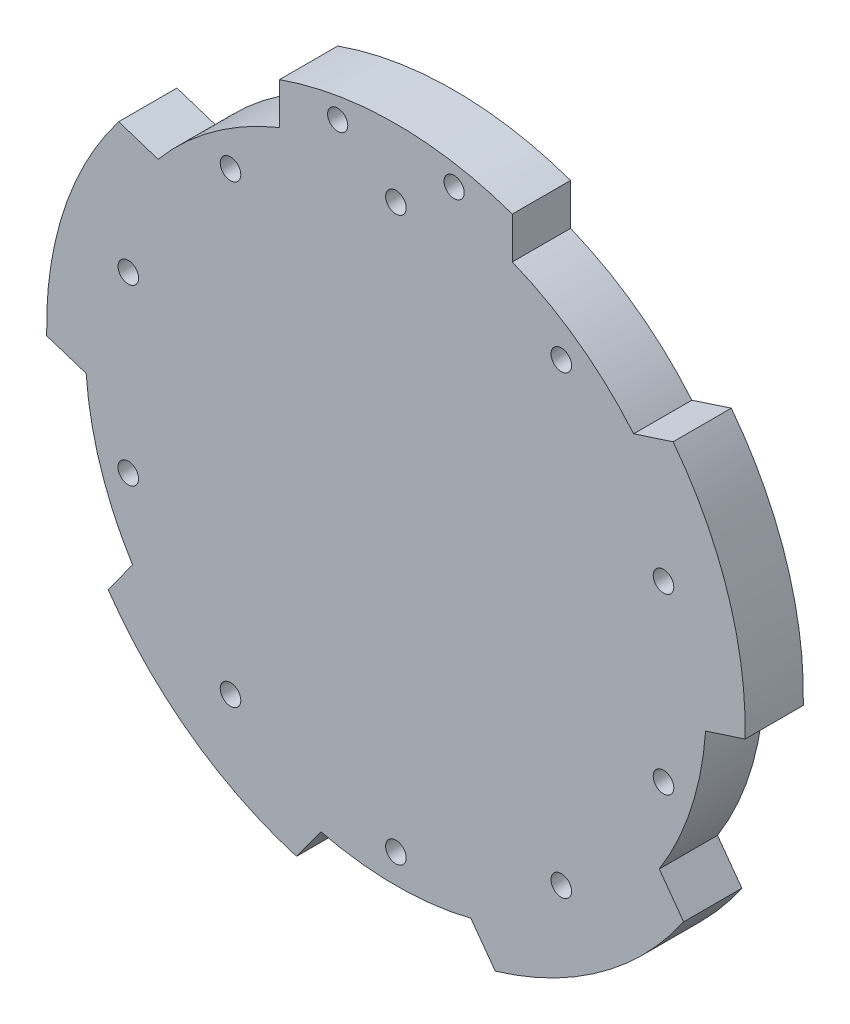
from build123d import *

# Parameters (mm, degrees)
SKIZZE1_R                       = 80
AUFSATZ_LINEAR_AUSTRAGEN1_DEPTH = 15
SKIZZE8_R                       = 2.65
SCHNITT_LINEAR_AUSTRAGEN1_DEPTH = 15
KREISMUSTER1_COUNT              = 10
SKIZZE9_R                       = 4.5
SCHNITT_LINEAR_AUSTRAGEN2_DEPTH = 5
KREISMUSTER2_COUNT              = 10
AUFSATZ_LINEAR_AUSTRAGEN2_DEPTH = 15
KREISMUSTER3_COUNT              = 5
SKIZZE11_R                      = 2.6
SCHNITT_LINEAR_AUSTRAGEN3_DEPTH = 15


with BuildPart() as part:
    # Skizze1 → Aufsatz-Linear austragen1 (new body)
    with BuildSketch(Plane.XY):
        Circle(SKIZZE1_R)
    extrude(amount=AUFSATZ_LINEAR_AUSTRAGEN1_DEPTH)

    # Skizze8 → Schnitt-Linear austragen1 (cut)
    with BuildSketch(Plane(origin=(0, 0, 0), x_dir=(-1, 0, 0), z_dir=(0, 0, -1))):
        with Locations((0, -72.5)):
            Circle(SKIZZE8_R)
    schnitt_linear_austragen1 = extrude(amount=-SCHNITT_LINEAR_AUSTRAGEN1_DEPTH, mode=Mode.SUBTRACT)

    # Kreismuster1: Schnitt-Linear austragen1 ×10 about axis
    kreismuster1_axis = Axis((0, 0, 0), (0, 0, 1))
    for i in range(1, KREISMUSTER1_COUNT):
        add(schnitt_linear_austragen1.rotate(kreismuster1_axis, i * 360 / KREISMUSTER1_COUNT), mode=Mode.SUBTRACT)

    # Skizze9 → Schnitt-Linear austragen2 (cut)
    with BuildSketch(Plane(origin=(0, 0, 0), x_dir=(-1, 0, 0), z_dir=(0, 0, -1))):
        with Locations((0, -72.5)):
            Circle(SKIZZE9_R)
    schnitt_linear_austragen2 = extrude(amount=-SCHNITT_LINEAR_AUSTRAGEN2_DEPTH, mode=Mode.SUBTRACT)

    # Kreismuster2: Schnitt-Linear austragen2 ×10 about axis
    kreismuster2_axis = Axis((0, 0, 0), (0, 0, 1))
    for i in range(1, KREISMUSTER2_COUNT):
        add(schnitt_linear_austragen2.rotate(kreismuster2_axis, i * 360 / KREISMUSTER2_COUNT), mode=Mode.SUBTRACT)

    # Skizze10 → Aufsatz-Linear austragen2 (add)
    with BuildSketch(Plane.XY.offset(15)):
        with BuildLine():
            Line((-30, 69.852813742), (-30, 84.852813742))
            ThreePointArc((-30, 84.852813742), (0, 90), (30, 84.852813742))
            Line((30, 84.852813742), (30, 69.852813742))
            Line((30, 69.852813742), (0, 80))
            Line((0, 80), (-30, 69.852813742))
        make_face()
    aufsatz_linear_austragen2 = extrude(amount=-AUFSATZ_LINEAR_AUSTRAGEN2_DEPTH)

    # Kreismuster3: Aufsatz-Linear austragen2 ×5 about axis
    kreismuster3_axis = Axis((0, 0, 0), (0, 0, 1))
    for i in range(1, KREISMUSTER3_COUNT):
        add(aufsatz_linear_austragen2.rotate(kreismuster3_axis, i * 360 / KREISMUSTER3_COUNT))

    # Skizze11 → Schnitt-Linear austragen3 (cut)
    with BuildSketch(Plane.XY.offset(15)):
        with Locations((-15, 83.4)):
            Circle(SKIZZE11_R)
        with Locations((15, 83.4)):
            Circle(SKIZZE11_R)
    extrude(amount=-SCHNITT_LINEAR_AUSTRAGEN3_DEPTH, mode=Mode.SUBTRACT)


solid = part.part
